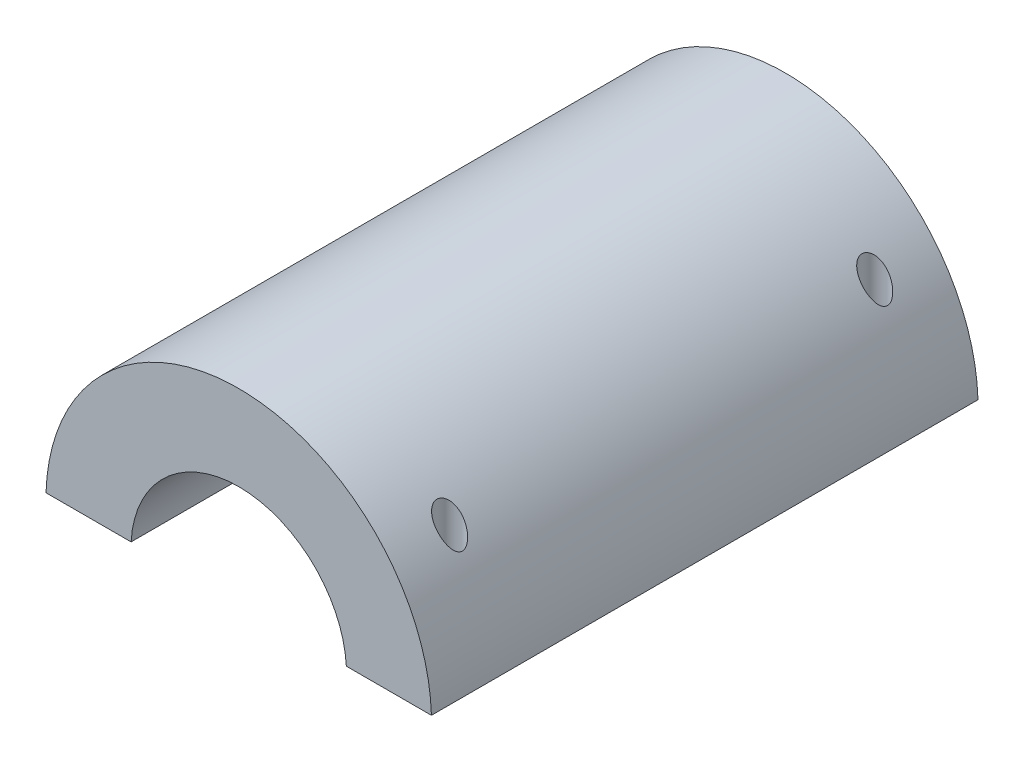
from build123d import *

# Parameters (mm, degrees)
BOSS_EXTRUDE1_DEPTH         = 90
TAP_DRILL_FOR_M5X0_8_TAP1_D = 4.2


with BuildPart() as part:
    # Sketch1 → Boss-Extrude1 (new body)
    with BuildSketch(Plane.XY):
        with BuildLine():
            Line((-31.734248061, 1), (-17.721808598, 1))
            ThreePointArc((-17.721808598, 1), (0, 17.75), (17.721808598, 1))
            Line((17.721808598, 1), (31.734248061, 1))
            ThreePointArc((31.734248061, 1), (0, 31.75), (-31.734248061, 1))
        make_face()
    extrude(amount=BOSS_EXTRUDE1_DEPTH)

    # Tap Drill for M5x0.8 Tap1 (through all)
    with Locations(Plane(origin=(-24.72802833, 1, 80), x_dir=(0, 0, -1), z_dir=(0, -1, 0))):
        with Locations((0, 0), (70, 0), (0, 49.45605666), (70, 49.45605666)):
            Hole(TAP_DRILL_FOR_M5X0_8_TAP1_D / 2)


solid = part.part
